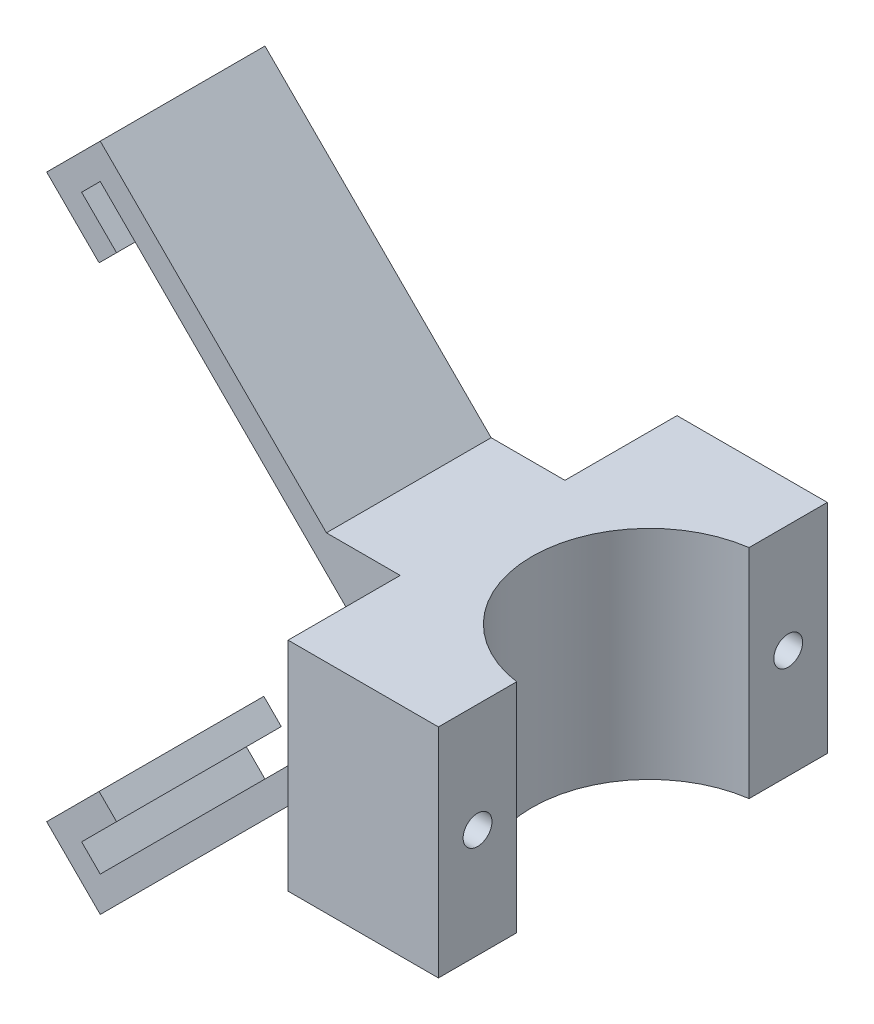
from build123d import *

# Parameters (mm, degrees)
BOSS_EXTRUDE1_DEPTH = 26.4
SKETCH2_R           = 1.75
CUT_EXTRUDE1_DEPTH  = 40.842252323
CUT_EXTRUDE3_START  = -10
CUT_EXTRUDE3_DEPTH  = 30.842252323
BOSS_EXTRUDE2_DEPTH = 10


with BuildPart() as part:
    # Sketch1 → Boss-Extrude1 (new body)
    with BuildSketch(Plane(origin=(0, 0, 0), x_dir=(1, 0, 0), z_dir=(0, 1, 0))):
        with BuildLine():
            Line((0, 23.60895106), (0, -23.60895106))
            Line((0, -23.60895106), (18.25, -23.60895106))
            Line((18.25, -23.60895106), (18.25, -14.10895106))
            ThreePointArc((18.25, -14.10895106), (6, 0), (18.25, 14.10895106))
            Line((18.25, 14.10895106), (18.25, 23.60895106))
            Line((18.25, 23.60895106), (0, 23.60895106))
        make_face()
    extrude(amount=BOSS_EXTRUDE1_DEPTH)

    # Sketch2 → Cut-Extrude1 (cut, through all)
    with BuildSketch(Plane(origin=(18.25, 0, 0), x_dir=(0, 0, -1), z_dir=(1, 0, 0))):
        with Locations((-18.85895106, 13.2)):
            Circle(SKETCH2_R)
    cut_extrude1 = extrude(amount=-CUT_EXTRUDE1_DEPTH, mode=Mode.SUBTRACT)

    # Sketch5 → Cut-Extrude3 (cut, through all)
    with BuildSketch(Plane(origin=(18.25, 0, 0), x_dir=(0, 0, -1), z_dir=(1, 0, 0)).offset(CUT_EXTRUDE3_START)):
        Polygon((-17.242370306, 16), (-20.475531813, 16), (-22.092112567, 13.2), (-20.475531813, 10.4), (-17.242370306, 10.4), (-15.625789552, 13.2), align=None)
    cut_extrude3 = extrude(amount=-CUT_EXTRUDE3_DEPTH, mode=Mode.SUBTRACT)

    # Mirror1: Cut-Extrude1, Cut-Extrude3 across plane
    add(cut_extrude1.mirror(Plane.XY), mode=Mode.SUBTRACT)
    add(cut_extrude3.mirror(Plane.XY), mode=Mode.SUBTRACT)

    # Sketch7 → Boss-Extrude2 (add, symmetric)
    with BuildSketch(Plane.XY):
        Polygon((0, 0), (-8.957359313, 0), (-36.415999231, -27.458639918), (-42.921381618, -20.953257531), (-36.557420587, -14.589296501), (-34.436100244, -16.710616844), (-38.678740931, -20.953257531), (-36.415999231, -23.215999231), (0, 13.2), (-36.415999231, 49.615999231), (-38.678740931, 47.353257531), (-34.436100244, 43.110616844), (-36.557420587, 40.989296501), (-42.921381618, 47.353257531), (-36.415999231, 53.858639918), (-8.957359313, 26.4), (0, 26.4), (6, 26.4), (6, 0), align=None)
    extrude(amount=BOSS_EXTRUDE2_DEPTH, both=True)


solid = part.part
